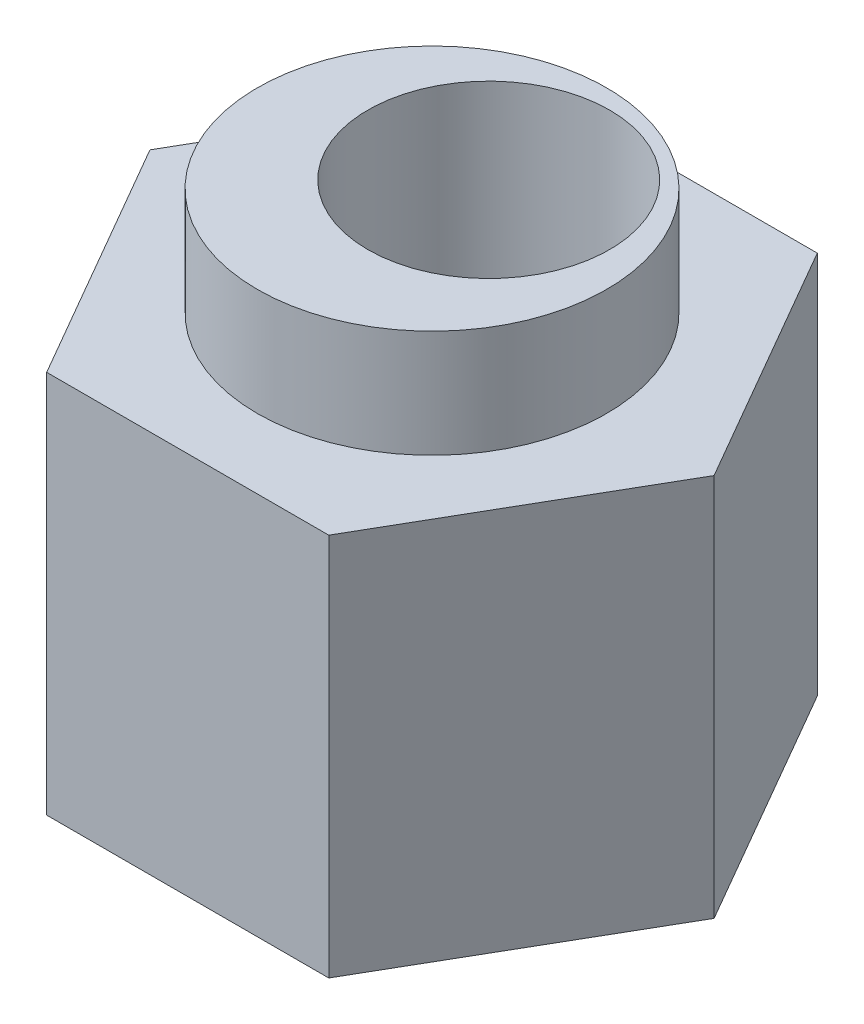
from build123d import *

# Parameters (mm, degrees)
BOSS_EXTRUDE1_DEPTH = 3.925
SKETCH2_R           = 3.575
BOSS_EXTRUDE2_DEPTH = 2.2
SKETCH3_R           = 2.475
CUT_EXTRUDE1_DEPTH  = 13.622829846
SKETCH4_R           = 3.5
SKETCH4_R_2         = 2.475
BOSS_EXTRUDE3_DEPTH = 0.5


with BuildPart() as part:
    # Sketch1 → Boss-Extrude1 (new, symmetric)
    with BuildSketch(Plane(origin=(0, 0, 0), x_dir=(1, 0, 0), z_dir=(0, 1, 0))):
        Polygon((2.886751346, 5), (-2.886751346, 5), (-5.773502692, 0), (-2.886751346, -5), (2.886751346, -5), (5.773502692, 0), align=None)
    extrude(amount=BOSS_EXTRUDE1_DEPTH, both=True)

    # Sketch2 → Boss-Extrude2 (add)
    with BuildSketch(Plane(origin=(0, 3.925, 0), x_dir=(1, 0, 0), z_dir=(0, 1, 0))):
        with Locations(Location((0, 0, 0), (0, 0, 270))):
            Circle(SKETCH2_R)
    extrude(amount=BOSS_EXTRUDE2_DEPTH)

    # Sketch3 → Cut-Extrude1 (cut, through all)
    with BuildSketch(Plane(origin=(0, 6.125, 0), x_dir=(1, 0, 0), z_dir=(0, 1, 0))):
        with Locations(Location((0.425, 0.736121593, 0), (0, 0, 270))):
            Circle(SKETCH3_R)
    extrude(amount=-CUT_EXTRUDE1_DEPTH, mode=Mode.SUBTRACT)

    # Sketch4 → Boss-Extrude3 (add)
    with BuildSketch(Plane.XZ.offset(3.925)):
        with Locations(Location((0.425, -0.736121593, 0), (0, 0, 90))):
            Circle(SKETCH4_R)
        with Locations(Location((0.425, -0.736121593, 0), (0, 0, 90))):
            Circle(SKETCH4_R_2, mode=Mode.SUBTRACT)
    extrude(amount=BOSS_EXTRUDE3_DEPTH)


solid = part.part
